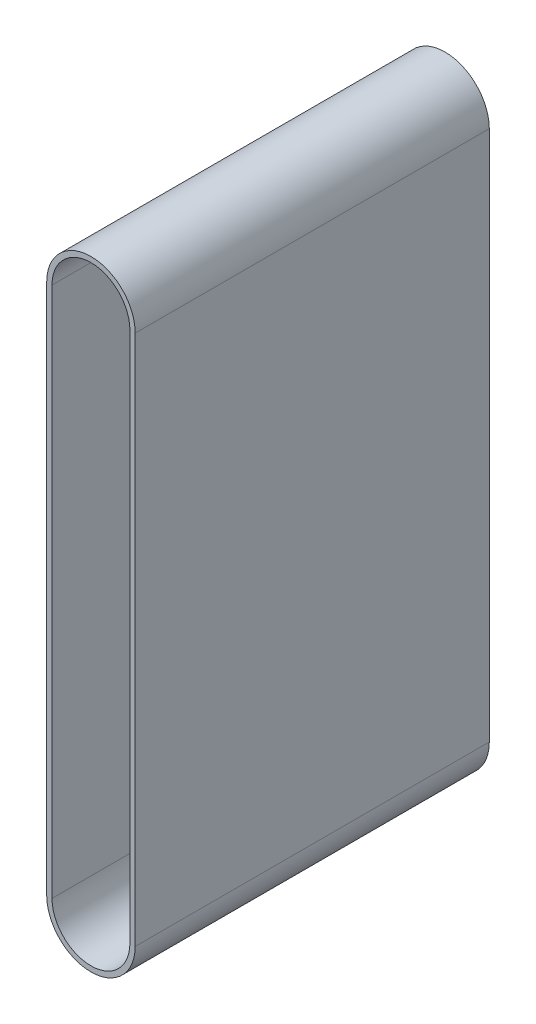
from build123d import *

# Parameters (mm, degrees)
BOSS_EXTRU_1_DEPTH      = 200
ENL_V_MAT_EXTRU_1_DEPTH = 200


with BuildPart() as part:
    # Esquisse1 → Boss.-Extru.1 (new body)
    with BuildSketch(Plane.XY):
        with BuildLine():
            Line((-25, 0), (-25, 300))
            ThreePointArc((-25, 300), (0, 325), (25, 300))
            Line((25, 300), (25, 0))
            ThreePointArc((25, 0), (0, -25), (-25, 0))
        make_face()
    extrude(amount=BOSS_EXTRU_1_DEPTH)

    # Esquisse2 → Enlèv. mat.-Extru.1 (cut)
    with BuildSketch(Plane.XY.offset(200)):
        with BuildLine():
            Line((22, 300), (22, 0))
            ThreePointArc((22, 0), (0, -22), (-22, 0))
            Line((-22, 0), (-22, 300))
            ThreePointArc((-22, 300), (0, 322), (22, 300))
        make_face()
    extrude(amount=-ENL_V_MAT_EXTRU_1_DEPTH, mode=Mode.SUBTRACT)


solid = part.part
